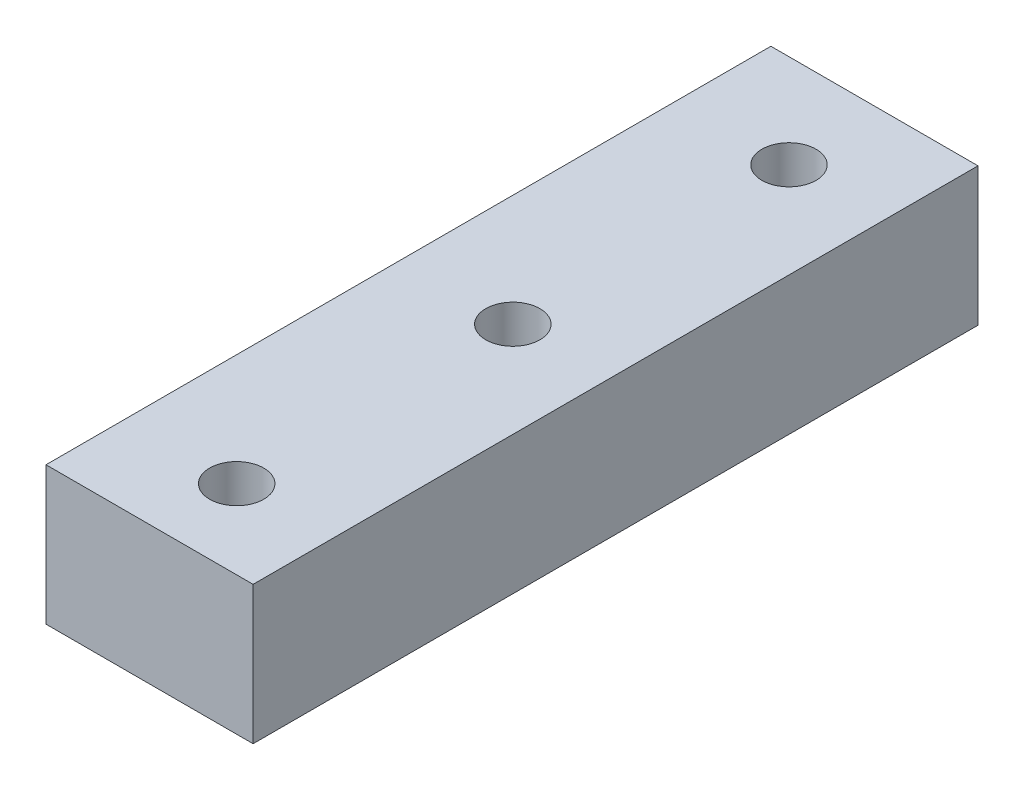
from build123d import *

# Parameters (mm, degrees)
BOSS_EXTRUDE1_DEPTH    = 12.7
F_10_CLEARANCE_HOLE1_D = 4.9784


with BuildPart() as part:
    # Sketch4 → Boss-Extrude1 (new body)
    with BuildSketch(Plane(origin=(0, 0, 0), x_dir=(1, 0, 0), z_dir=(0, 1, 0))):
        Polygon((-71.608792588, 6.232898137), (-71.608792588, 28.457898137), (-52.558792588, 28.457898137), (-52.558792588, -12.817101863), (-52.558792588, -38.217101863), (-71.608792588, -38.217101863), (-71.608792588, -12.817101863), align=None)
    extrude(amount=BOSS_EXTRUDE1_DEPTH)

    # #10 Clearance Hole1 (through all)
    with Locations(Plane(origin=(0, 12.7, 0), x_dir=(1, 0, 0), z_dir=(0, 1, 0))):
        with Locations((-61.333792588, 19.847622446), (-61.333792588, -5.552377554), (-61.333792588, -30.952377554)):
            Hole(F_10_CLEARANCE_HOLE1_D / 2)


solid = part.part
